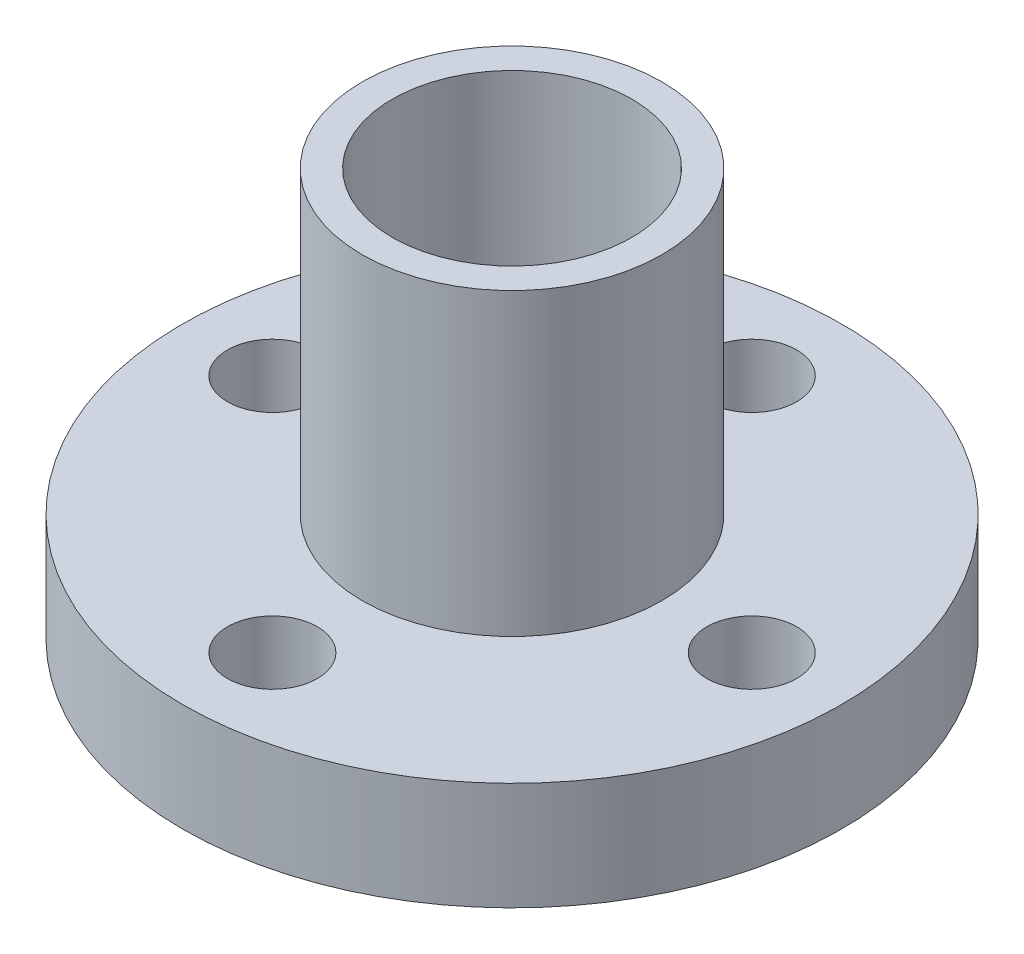
from build123d import *

# Parameters (mm, degrees)
SKETCH1_R           = 11
BOSS_EXTRUDE1_DEPTH = 3.6
SKETCH2_R           = 5
BOSS_EXTRUDE2_DEPTH = 10
BOSS_EXTRUDE3_START = 1.5
SKETCH3_R           = 5
BOSS_EXTRUDE3_DEPTH = 1.5
SKETCH4_R           = 4
CUT_EXTRUDE1_DEPTH  = 22.67971402
SKETCH5_R           = 1.5
CUT_EXTRUDE2_DEPTH  = 19.493242009
CIRPATTERN1_COUNT   = 4


with BuildPart() as part:
    # Sketch1 → Boss-Extrude1 (new body)
    with BuildSketch(Plane(origin=(0, 0, 0), x_dir=(1, 0, 0), z_dir=(0, 1, 0))):
        with Locations(Location((0, 0, 0), (0, 0, 270))):
            Circle(SKETCH1_R)
    extrude(amount=BOSS_EXTRUDE1_DEPTH)

    # Sketch2 → Boss-Extrude2 (add)
    with BuildSketch(Plane(origin=(0, 3.6, 0), x_dir=(1, 0, 0), z_dir=(0, 1, 0))):
        with Locations(Location((0, 0, 0), (0, 0, 270))):
            Circle(SKETCH2_R)
    extrude(amount=BOSS_EXTRUDE2_DEPTH)

    # Sketch3 → Boss-Extrude3 (add)
    with BuildSketch(Plane.XZ.offset(BOSS_EXTRUDE3_START)):
        with Locations(Location((0, 0, 0), (0, 0, 90))):
            Circle(SKETCH3_R)
    extrude(amount=-BOSS_EXTRUDE3_DEPTH)

    # Sketch4 → Cut-Extrude1 (cut, through all)
    with BuildSketch(Plane(origin=(0, 13.6, 0), x_dir=(1, 0, 0), z_dir=(0, 1, 0))):
        with Locations(Location((0, 0, 0), (0, 0, 270))):
            Circle(SKETCH4_R)
    extrude(amount=-CUT_EXTRUDE1_DEPTH, mode=Mode.SUBTRACT)

    # Sketch5 → Cut-Extrude2 (cut, symmetric)
    with BuildSketch(Plane(origin=(0, 3.6, 0), x_dir=(1, 0, 0), z_dir=(0, 1, 0))):
        with Locations(Location((0, 8, 0), (0, 0, 270))):
            Circle(SKETCH5_R)
    cut_extrude2 = extrude(amount=CUT_EXTRUDE2_DEPTH, both=True, mode=Mode.SUBTRACT)

    # CirPattern1: Cut-Extrude2 ×4 about axis
    cirpattern1_axis = Axis((0, 0, 0), (0, 1, 0))
    for i in range(1, CIRPATTERN1_COUNT):
        add(cut_extrude2.rotate(cirpattern1_axis, i * 360 / CIRPATTERN1_COUNT), mode=Mode.SUBTRACT)


solid = part.part
